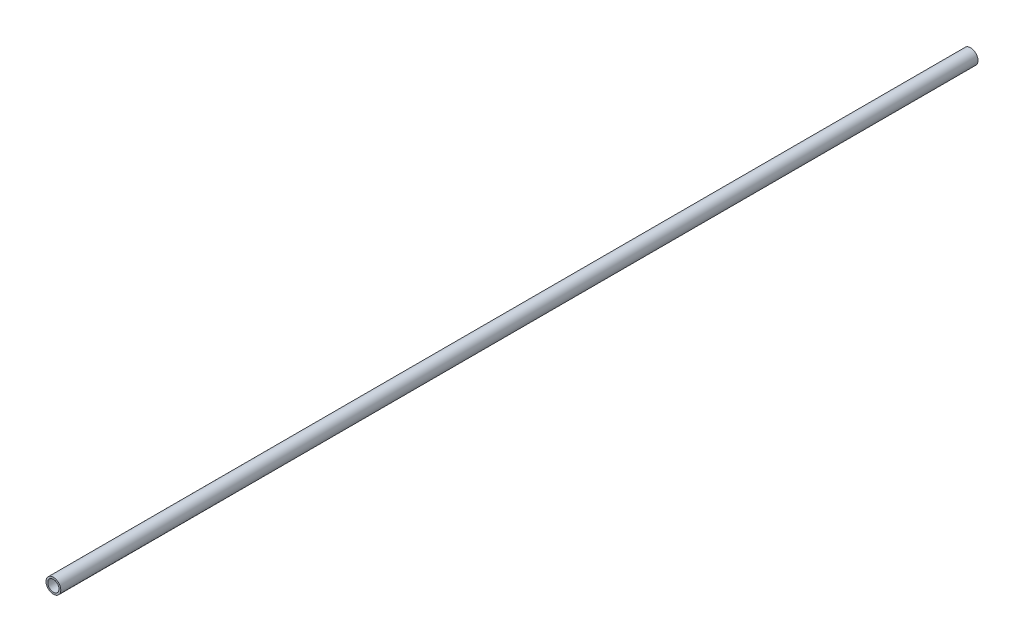
from build123d import *

# Parameters (mm, degrees)
SKETCH1_R           = 16.7005
SKETCH1_R_2         = 12.7
BOSS_EXTRUDE1_DEPTH = 2072.386


with BuildPart() as part:
    # Sketch1 → Boss-Extrude1 (new body)
    with BuildSketch(Plane.XY):
        Circle(SKETCH1_R)
        Circle(SKETCH1_R_2, mode=Mode.SUBTRACT)
    extrude(amount=BOSS_EXTRUDE1_DEPTH)


solid = part.part
